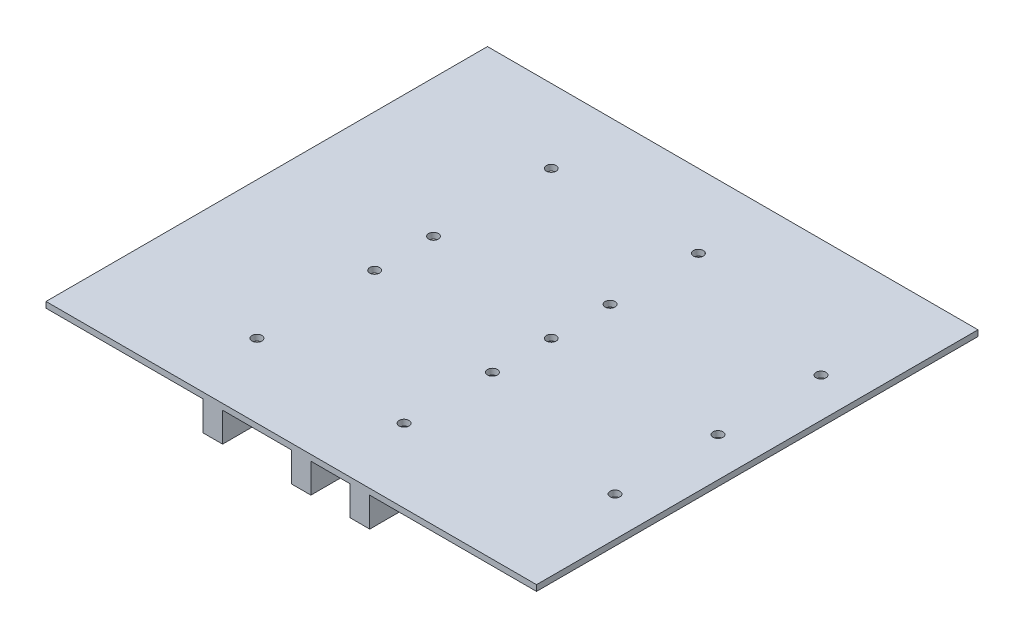
from build123d import *

# Parameters (mm, degrees)
SKETCH1_W           = 500
SKETCH1_H           = 450
BOSS_EXTRUDE1_DEPTH = 6
CUT_EXTRUDE1_REACH  = 338.394
SKETCH2_R           = 5
SKETCH3_W           = 20
SKETCH3_H           = 450
BOSS_EXTRUDE2_DEPTH = 30


with BuildPart() as part:
    # Sketch1 → Boss-Extrude1 (new body)
    with BuildSketch(Plane(origin=(0, 0, 0), x_dir=(1, 0, 0), z_dir=(0, 1, 0))):
        Rectangle(SKETCH1_W, SKETCH1_H)
    extrude(amount=BOSS_EXTRUDE1_DEPTH)

    # Sketch2 → Cut-Extrude1 (cut, up to next)
    with BuildSketch(Plane(origin=(0, 6, 0), x_dir=(1, 0, 0), z_dir=(0, 1, 0)), mode=Mode.PRIVATE) as cut_extrude1_sk1:
        with Locations(Location((210, 105, 0), (0, 0, 270))):
            Circle(SKETCH2_R)
    cut_extrude1_tool1 = extrude(cut_extrude1_sk1.sketch, amount=-CUT_EXTRUDE1_REACH, mode=Mode.PRIVATE) & part.part
    # Sketch2 → Cut-Extrude1 (cut, up to next)
    with BuildSketch(Plane(origin=(0, 6, 0), x_dir=(1, 0, 0), z_dir=(0, 1, 0)), mode=Mode.PRIVATE) as cut_extrude1_sk2:
        with Locations(Location((210, -105, 0), (0, 0, 270))):
            Circle(SKETCH2_R)
    cut_extrude1_tool2 = extrude(cut_extrude1_sk2.sketch, amount=-CUT_EXTRUDE1_REACH, mode=Mode.PRIVATE) & part.part
    # Sketch2 → Cut-Extrude1 (cut, up to next)
    with BuildSketch(Plane(origin=(0, 6, 0), x_dir=(1, 0, 0), z_dir=(0, 1, 0)), mode=Mode.PRIVATE) as cut_extrude1_sk3:
        with Locations(Location((210, 0, 0), (0, 0, 270))):
            Circle(SKETCH2_R)
    cut_extrude1_tool3 = extrude(cut_extrude1_sk3.sketch, amount=-CUT_EXTRUDE1_REACH, mode=Mode.PRIVATE) & part.part
    # Sketch2 → Cut-Extrude1 (cut, up to next)
    with BuildSketch(Plane(origin=(0, 6, 0), x_dir=(1, 0, 0), z_dir=(0, 1, 0)), mode=Mode.PRIVATE) as cut_extrude1_sk4:
        with Locations(Location((40, 150, 0), (0, 0, 270))):
            Circle(SKETCH2_R)
    cut_extrude1_tool4 = extrude(cut_extrude1_sk4.sketch, amount=-CUT_EXTRUDE1_REACH, mode=Mode.PRIVATE) & part.part
    # Sketch2 → Cut-Extrude1 (cut, up to next)
    with BuildSketch(Plane(origin=(0, 6, 0), x_dir=(1, 0, 0), z_dir=(0, 1, 0)), mode=Mode.PRIVATE) as cut_extrude1_sk5:
        with Locations(Location((40, 60, 0), (0, 0, 270))):
            Circle(SKETCH2_R)
    cut_extrude1_tool5 = extrude(cut_extrude1_sk5.sketch, amount=-CUT_EXTRUDE1_REACH, mode=Mode.PRIVATE) & part.part
    # Sketch2 → Cut-Extrude1 (cut, up to next)
    with BuildSketch(Plane(origin=(0, 6, 0), x_dir=(1, 0, 0), z_dir=(0, 1, 0)), mode=Mode.PRIVATE) as cut_extrude1_sk6:
        with Locations(Location((40, 0, 0), (0, 0, 270))):
            Circle(SKETCH2_R)
    cut_extrude1_tool6 = extrude(cut_extrude1_sk6.sketch, amount=-CUT_EXTRUDE1_REACH, mode=Mode.PRIVATE) & part.part
    # Sketch2 → Cut-Extrude1 (cut, up to next)
    with BuildSketch(Plane(origin=(0, 6, 0), x_dir=(1, 0, 0), z_dir=(0, 1, 0)), mode=Mode.PRIVATE) as cut_extrude1_sk7:
        with Locations(Location((-110, 150, 0), (0, 0, 270))):
            Circle(SKETCH2_R)
    cut_extrude1_tool7 = extrude(cut_extrude1_sk7.sketch, amount=-CUT_EXTRUDE1_REACH, mode=Mode.PRIVATE) & part.part
    # Sketch2 → Cut-Extrude1 (cut, up to next)
    with BuildSketch(Plane(origin=(0, 6, 0), x_dir=(1, 0, 0), z_dir=(0, 1, 0)), mode=Mode.PRIVATE) as cut_extrude1_sk8:
        with Locations(Location((-110, 30, 0), (0, 0, 270))):
            Circle(SKETCH2_R)
    cut_extrude1_tool8 = extrude(cut_extrude1_sk8.sketch, amount=-CUT_EXTRUDE1_REACH, mode=Mode.PRIVATE) & part.part
    # Sketch2 → Cut-Extrude1 (cut, up to next)
    with BuildSketch(Plane(origin=(0, 6, 0), x_dir=(1, 0, 0), z_dir=(0, 1, 0)), mode=Mode.PRIVATE) as cut_extrude1_sk9:
        with Locations(Location((-110, -30, 0), (0, 0, 270))):
            Circle(SKETCH2_R)
    cut_extrude1_tool9 = extrude(cut_extrude1_sk9.sketch, amount=-CUT_EXTRUDE1_REACH, mode=Mode.PRIVATE) & part.part
    # Sketch2 → Cut-Extrude1 (cut, up to next)
    with BuildSketch(Plane(origin=(0, 6, 0), x_dir=(1, 0, 0), z_dir=(0, 1, 0)), mode=Mode.PRIVATE) as cut_extrude1_sk10:
        with Locations(Location((40, -60, 0), (0, 0, 270))):
            Circle(SKETCH2_R)
    cut_extrude1_tool10 = extrude(cut_extrude1_sk10.sketch, amount=-CUT_EXTRUDE1_REACH, mode=Mode.PRIVATE) & part.part
    # Sketch2 → Cut-Extrude1 (cut, up to next)
    with BuildSketch(Plane(origin=(0, 6, 0), x_dir=(1, 0, 0), z_dir=(0, 1, 0)), mode=Mode.PRIVATE) as cut_extrude1_sk11:
        with Locations(Location((40, -150, 0), (0, 0, 270))):
            Circle(SKETCH2_R)
    cut_extrude1_tool11 = extrude(cut_extrude1_sk11.sketch, amount=-CUT_EXTRUDE1_REACH, mode=Mode.PRIVATE) & part.part
    # Sketch2 → Cut-Extrude1 (cut, up to next)
    with BuildSketch(Plane(origin=(0, 6, 0), x_dir=(1, 0, 0), z_dir=(0, 1, 0)), mode=Mode.PRIVATE) as cut_extrude1_sk12:
        with Locations(Location((-110, -150, 0), (0, 0, 270))):
            Circle(SKETCH2_R)
    cut_extrude1_tool12 = extrude(cut_extrude1_sk12.sketch, amount=-CUT_EXTRUDE1_REACH, mode=Mode.PRIVATE) & part.part
    add(cut_extrude1_tool1.solids().sort_by_distance((210, 6, -105))[0], mode=Mode.SUBTRACT)
    add(cut_extrude1_tool2.solids().sort_by_distance((210, 6, 105))[0], mode=Mode.SUBTRACT)
    add(cut_extrude1_tool3.solids().sort_by_distance((210, 6, 0))[0], mode=Mode.SUBTRACT)
    add(cut_extrude1_tool4.solids().sort_by_distance((40, 6, -150))[0], mode=Mode.SUBTRACT)
    add(cut_extrude1_tool5.solids().sort_by_distance((40, 6, -60))[0], mode=Mode.SUBTRACT)
    add(cut_extrude1_tool6.solids().sort_by_distance((40, 6, 0))[0], mode=Mode.SUBTRACT)
    add(cut_extrude1_tool7.solids().sort_by_distance((-110, 6, -150))[0], mode=Mode.SUBTRACT)
    add(cut_extrude1_tool8.solids().sort_by_distance((-110, 6, -30))[0], mode=Mode.SUBTRACT)
    add(cut_extrude1_tool9.solids().sort_by_distance((-110, 6, 30))[0], mode=Mode.SUBTRACT)
    add(cut_extrude1_tool10.solids().sort_by_distance((40, 6, 60))[0], mode=Mode.SUBTRACT)
    add(cut_extrude1_tool11.solids().sort_by_distance((40, 6, 150))[0], mode=Mode.SUBTRACT)
    add(cut_extrude1_tool12.solids().sort_by_distance((-110, 6, 150))[0], mode=Mode.SUBTRACT)

    # Sketch3 → Boss-Extrude2 (add)
    with BuildSketch(Plane.XZ):
        with Locations((10, 0)):
            Rectangle(SKETCH3_W, SKETCH3_H)
        with Locations((-80, 0)):
            Rectangle(SKETCH3_W, SKETCH3_H)
        with Locations((70, 0)):
            Rectangle(SKETCH3_W, SKETCH3_H)
    extrude(amount=BOSS_EXTRUDE2_DEPTH)


solid = part.part
